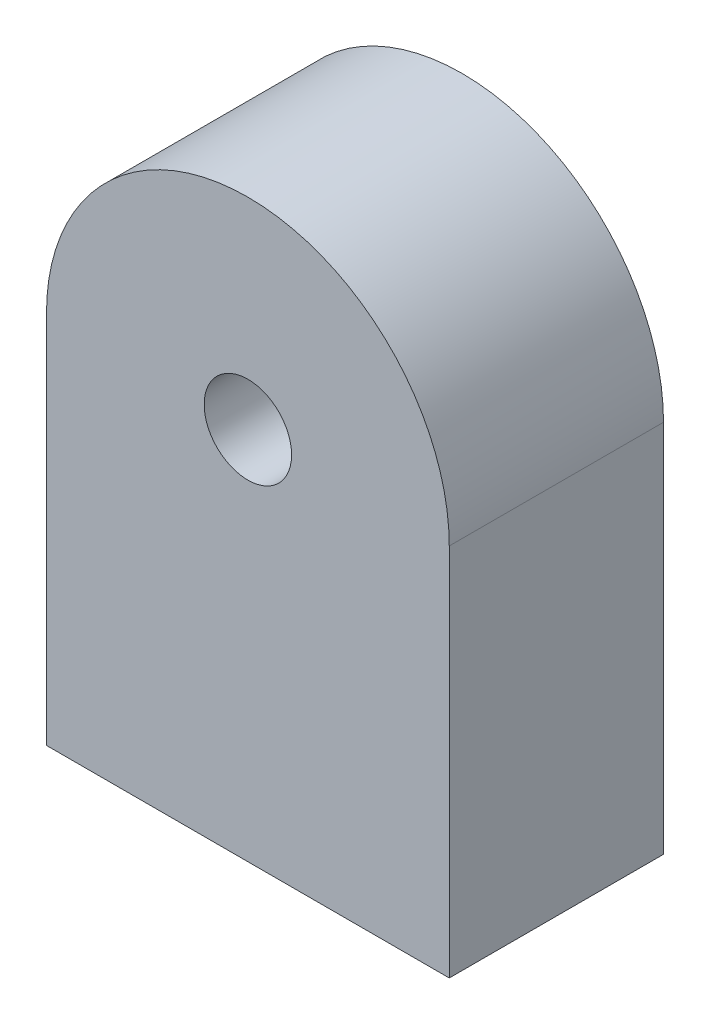
from build123d import *

# Parameters (mm, degrees)
ESQUISSE1_R        = 0.51
BOSS_EXTRU_1_DEPTH = 2.5


with BuildPart() as part:
    # Esquisse1 → Boss.-Extru.1 (new body)
    with BuildSketch(Plane.XY):
        with BuildLine():
            Line((-6.033689168, 0), (-6.033689168, 4.366158339))
            ThreePointArc((-6.033689168, 4.366158339), (-3.683689168, 6.716158339), (-1.333689168, 4.366158339))
            Line((-1.333689168, 4.366158339), (-1.333689168, 0))
            Line((-1.333689168, 0), (-6.033689168, 0))
        make_face()
        with Locations((-3.683689168, 4.366158339)):
            Circle(ESQUISSE1_R, mode=Mode.SUBTRACT)
    extrude(amount=BOSS_EXTRU_1_DEPTH)


solid = part.part
